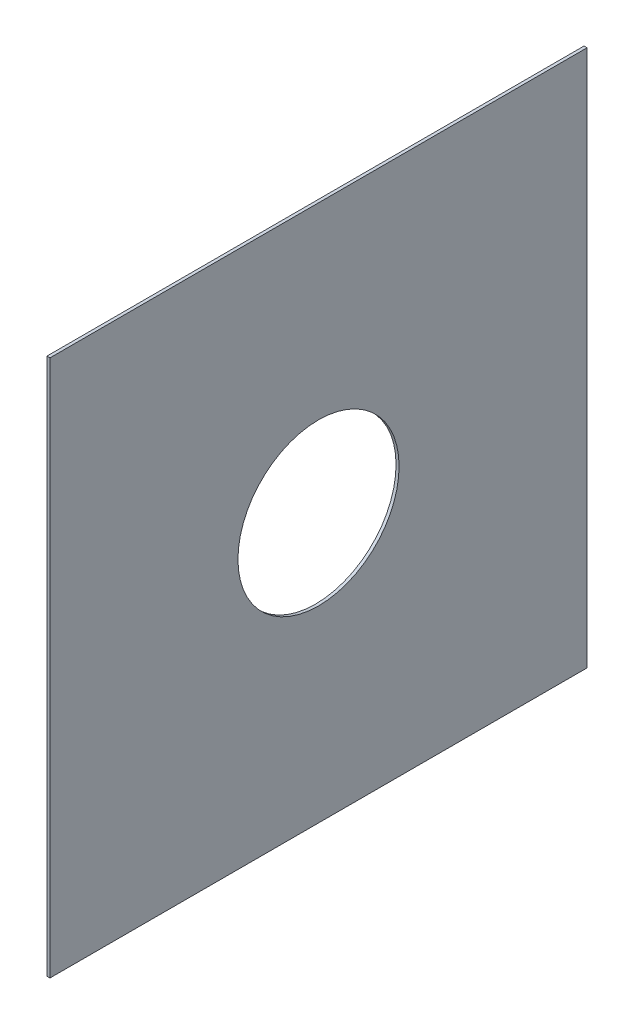
from build123d import *

# Parameters (mm, degrees)
CROQUIS1_W     = 530
CROQUIS1_H     = 530
EXTRUIR1_DEPTH = 3
CROQUIS3_R     = 79.5
EXTRUIR2_DEPTH = 375.77860131


with BuildPart() as part:
    # Croquis1 → Extruir1 (new body)
    with BuildSketch(Plane(origin=(0, 0, 0), x_dir=(0, -1, 0), z_dir=(1, 0, 0))):
        Rectangle(CROQUIS1_W, CROQUIS1_H)
    extrude(amount=EXTRUIR1_DEPTH)

    # Croquis3 → Extruir2 (cut, through all)
    with BuildSketch(Plane.ZY):
        Circle(CROQUIS3_R)
    extrude(amount=-EXTRUIR2_DEPTH, mode=Mode.SUBTRACT)


solid = part.part
